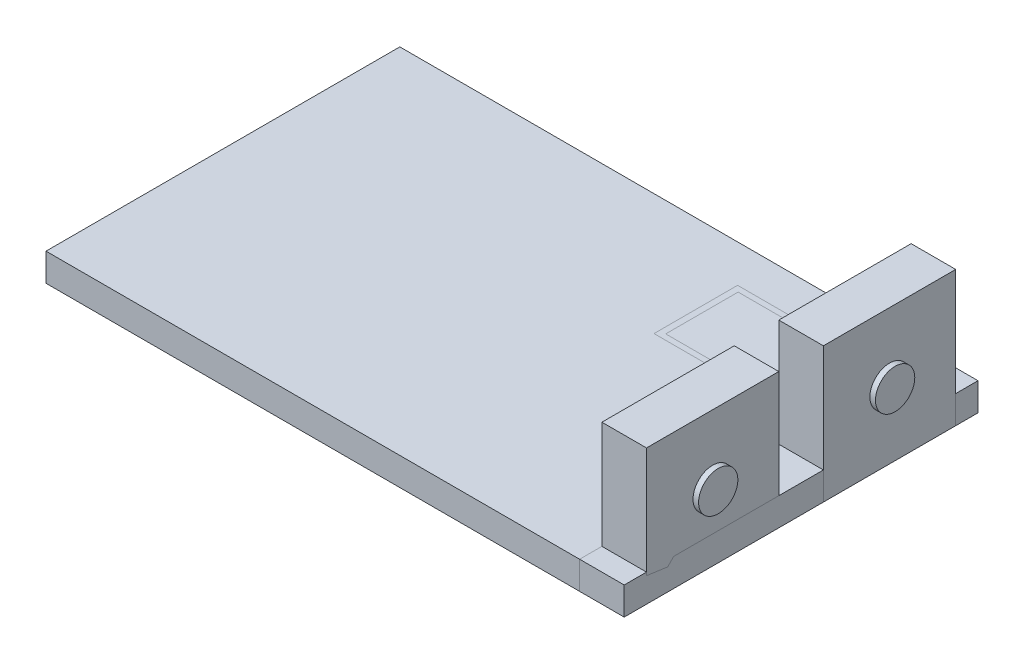
from build123d import *

# Parameters (mm, degrees)
SKETCH1_W             = 21
SKETCH1_H             = 15
BOSS_EXTRUDE1_DEPTH   = 5
SKETCH1_3_W           = 8
SKETCH1_3_H           = 4
BOSS_EXTRUDE2_DEPTH   = 5
SKETCH1_3_H_2         = 35.75
BOSS_EXTRUDE2_2_DEPTH = 5
BOSS_EXTRUDE3_DEPTH   = 24.3
BOSS_EXTRUDE3_2_DEPTH = 24.3
BOSS_EXTRUDE4_START   = 4.5
SKETCH1_5_W           = 18.8
SKETCH1_5_H           = 13
BOSS_EXTRUDE4_DEPTH   = 0.5
BOSS_EXTRUDE5_START   = 3
SKETCH1_6_W           = 21
SKETCH1_6_H           = 15
SKETCH1_6_W_2         = 18.8
SKETCH1_6_H_2         = 13
BOSS_EXTRUDE5_DEPTH   = 2
SKETCH2_R             = 3.528024563
BOSS_EXTRUDE6_DEPTH   = 1
SKETCH2_R_2           = 3.524637116
BOSS_EXTRUDE6_2_DEPTH = 1


with BuildPart() as part:
    # Sketch1 → Boss-Extrude1 (new body)
    with BuildSketch(Plane(origin=(0, 0, 0), x_dir=(1, 0, 0), z_dir=(0, 1, 0))):
        Polygon((35.4, 27.75), (35.4, 31.75), (-60.375, 31.75), (-60.375, -31.75), (35.4, -31.75), (35.4, -27.75), (35.4, -4), (35.4, 4), align=None)
        with Locations((17.5, 17.5)):
            Rectangle(SKETCH1_W, SKETCH1_H, mode=Mode.SUBTRACT)
    extrude(amount=BOSS_EXTRUDE1_DEPTH)


with BuildPart() as body_2:
    # Sketch1<3> → Boss-Extrude2 (new body)
    with BuildSketch(Plane(origin=(0, 0, 0), x_dir=(1, 0, 0), z_dir=(0, 1, 0))):
        with Locations((39.4, 29.75)):
            Rectangle(SKETCH1_3_W, SKETCH1_3_H)
    extrude(amount=BOSS_EXTRUDE2_DEPTH)


with BuildPart() as body_3:
    # Sketch1<3> → Boss-Extrude2 2 (new body)
    with BuildSketch(Plane(origin=(0, 0, 0), x_dir=(1, 0, 0), z_dir=(0, 1, 0))):
        with Locations((39.4, -13.875)):
            Rectangle(SKETCH1_3_W, SKETCH1_3_H_2)
    extrude(amount=BOSS_EXTRUDE2_2_DEPTH)


with BuildPart() as body_4:
    # Sketch1<4> → Boss-Extrude3 (new body)
    with BuildSketch(Plane(origin=(0, 0, 0), x_dir=(1, 0, 0), z_dir=(0, 1, 0))):
        Polygon((43.4, 4), (43.4, 27.75), (35.4, 27.75), (35.4, 4), (39.4, 4), align=None)
    extrude(amount=BOSS_EXTRUDE3_DEPTH)


with BuildPart() as body_5:
    # Sketch1<4> → Boss-Extrude3 2 (new body)
    with BuildSketch(Plane(origin=(0, 0, 0), x_dir=(1, 0, 0), z_dir=(0, 1, 0))):
        Polygon((43.4, -27.75), (43.4, -4), (39.4, -4), (35.4, -4), (35.4, -27.75), align=None)
    extrude(amount=BOSS_EXTRUDE3_2_DEPTH)


with BuildPart() as body_6:
    # Sketch1<5> → Boss-Extrude4 (new body)
    with BuildSketch(Plane(origin=(0, 0, 0), x_dir=(1, 0, 0), z_dir=(0, 1, 0)).offset(BOSS_EXTRUDE4_START)):
        with Locations((17.5, 17.499967273)):
            Rectangle(SKETCH1_5_W, SKETCH1_5_H)
    extrude(amount=BOSS_EXTRUDE4_DEPTH)


with BuildPart() as body_7:
    # Sketch1<6> → Boss-Extrude5 (new body)
    with BuildSketch(Plane(origin=(0, 0, 0), x_dir=(1, 0, 0), z_dir=(0, 1, 0)).offset(BOSS_EXTRUDE5_START)):
        with Locations((17.5, 17.5)):
            Rectangle(SKETCH1_6_W, SKETCH1_6_H)
        with Locations((17.5, 17.499967273)):
            Rectangle(SKETCH1_6_W_2, SKETCH1_6_H_2, mode=Mode.SUBTRACT)
    extrude(amount=BOSS_EXTRUDE5_DEPTH)


with BuildPart() as body_8:
    # Sketch2 → Boss-Extrude6 (new body)
    with BuildSketch(Plane(origin=(43.4, 0, 0), x_dir=(0, 0, -1), z_dir=(1, 0, 0))):
        with Locations((15.875, 12.15)):
            Circle(SKETCH2_R)
    extrude(amount=BOSS_EXTRUDE6_DEPTH)


with BuildPart() as body_9:
    # Sketch2 → Boss-Extrude6 2 (new body)
    with BuildSketch(Plane(origin=(43.4, 0, 0), x_dir=(0, 0, -1), z_dir=(1, 0, 0))):
        with Locations((-15.875, 12.15)):
            Circle(SKETCH2_R_2)
    extrude(amount=BOSS_EXTRUDE6_2_DEPTH)


solid = Compound([part.part, body_2.part, body_3.part, body_4.part, body_5.part, body_6.part, body_7.part, body_8.part, body_9.part])
